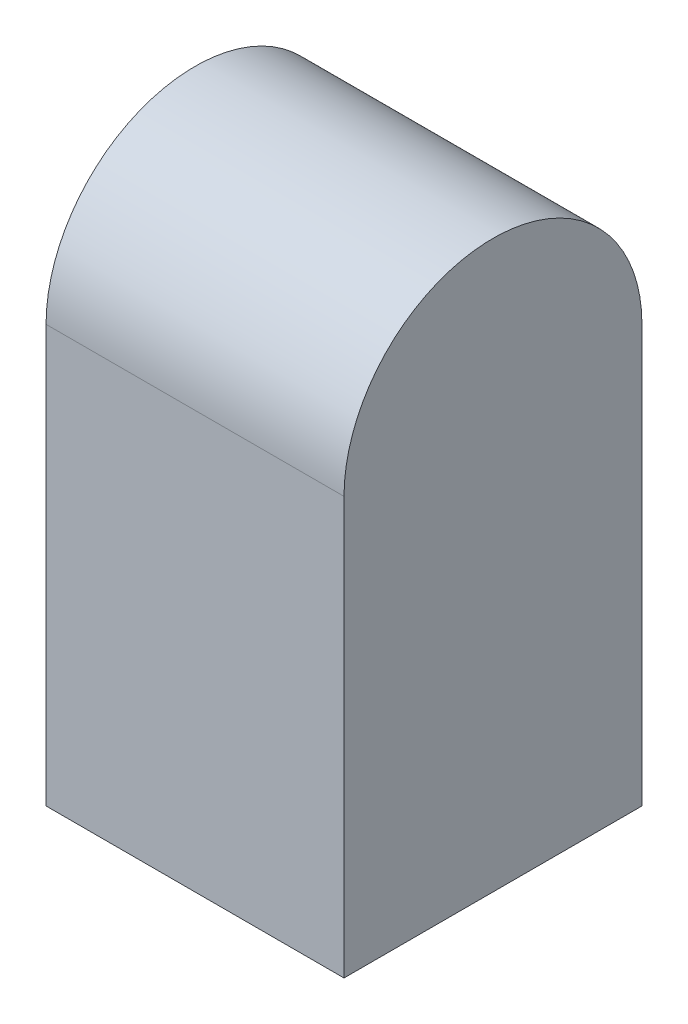
from build123d import *

# Parameters (mm, degrees)
ESQUISSE1_W        = 25
ESQUISSE1_H        = 25
BOSS_EXTRU_1_DEPTH = 35
BOSS_EXTRU_2_DEPTH = 25


with BuildPart() as part:
    # Esquisse1 → Boss.-Extru.1 (new body)
    with BuildSketch(Plane(origin=(0, 0, 0), x_dir=(1, 0, 0), z_dir=(0, 1, 0))):
        Rectangle(ESQUISSE1_W, ESQUISSE1_H)
    extrude(amount=BOSS_EXTRU_1_DEPTH)

    # Esquisse2 → Boss.-Extru.2 (add)
    with BuildSketch(Plane(origin=(12.5, 0, 0), x_dir=(0, 0, -1), z_dir=(1, 0, 0))):
        with BuildLine():
            Line((-12.5, 35), (12.5, 35))
            ThreePointArc((12.5, 35), (0, 47.5), (-12.5, 35))
        make_face()
    extrude(amount=-BOSS_EXTRU_2_DEPTH)


solid = part.part
